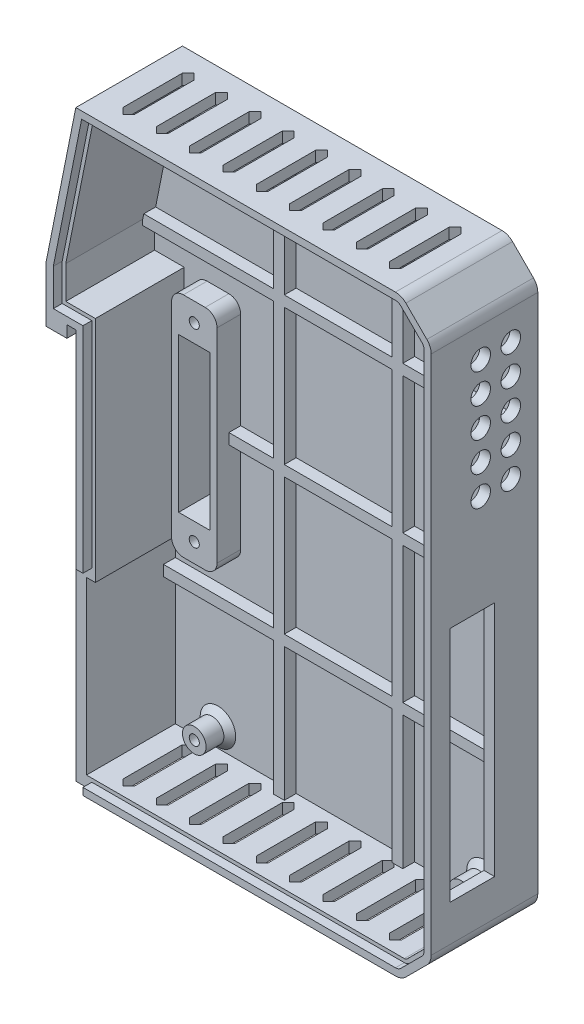
from build123d import *

# Parameters (mm, degrees)
BOSS_EXTRUDE1_DEPTH = 1.5
BOSS_EXTRUDE2_DEPTH = 16.5
BOSS_EXTRUDE3_DEPTH = 4
SKETCH5_W           = 18.2
SKETCH5_H           = 23
BOSS_EXTRUDE4_DEPTH = 2
SKETCH6_R           = 2
BOSS_EXTRUDE5_DEPTH = 4
CHAMFER1_SIZE       = 1
SKETCH7_W           = 3.5
SKETCH7_H           = 32.5
CUT_EXTRUDE1_DEPTH  = 0.5
SKETCH8_W           = 1.4
SKETCH8_H           = 21
BOSS_EXTRUDE6_DEPTH = 2.9
SKETCH9_R           = 0.85
CUT_EXTRUDE2_DEPTH  = 4
SKETCH10_W          = 5.28
SKETCH10_H          = 26
CUT_EXTRUDE3_DEPTH  = 120.921849552
SKETCH11_R          = 0.85
CUT_EXTRUDE4_DEPTH  = 4
CUT_EXTRUDE5_START  = -1.5
CUT_EXTRUDE5_DEPTH  = 1.5
SKETCH15_W          = 2.7
SKETCH15_H          = 32.5
CUT_EXTRUDE6_DEPTH  = 1.5
CUT_EXTRUDE7_DEPTH  = 1.8
SKETCH17_W          = 7.517
SKETCH17_H          = 40.043
CUT_EXTRUDE8_DEPTH  = 1.8
SKETCH18_R          = 1.65
CUT_EXTRUDE9_DEPTH  = 1.8


with BuildPart() as part:
    # Sketch2 → Boss-Extrude1 (new body)
    with BuildSketch(Plane.XY):
        with BuildLine():
            Line((0, 0), (58.964466094, 0))
            ThreePointArc((58.964466094, 0), (59.921174675, 0.190301169), (60.732233047, 0.732233047))
            Line((60.732233047, 0.732233047), (64.267766953, 4.267766953))
            ThreePointArc((64.267766953, 4.267766953), (64.809698831, 5.078825325), (65, 6.035533906))
            Line((65, 6.035533906), (65, 93.964466094))
            ThreePointArc((65, 93.964466094), (64.809698831, 94.921174675), (64.267766953, 95.732233047))
            Line((64.267766953, 95.732233047), (60.732233047, 99.267766953))
            ThreePointArc((60.732233047, 99.267766953), (59.921174675, 99.809698831), (58.964466094, 100))
            Line((58.964466094, 100), (5, 100))
            Line((5, 100), (0, 75))
            Line((0, 75), (0, 65.5))
            Line((0, 65.5), (3.5, 65.5))
            Line((3.5, 65.5), (3.5, 67.5))
            Line((3.5, 67.5), (5, 67.5))
            Line((5, 67.5), (5, 32.5))
            Line((5, 32.5), (0, 32.5))
            Line((0, 32.5), (0, 0))
        make_face()
    extrude(amount=BOSS_EXTRUDE1_DEPTH)

    # Sketch3 → Boss-Extrude2 (add)
    with BuildSketch(Plane.XY.offset(1.5)):
        with BuildLine():
            Line((5, 32.5), (3.5, 32.5))
            Line((3.5, 32.5), (3.5, 0))
            Line((3.5, 0), (58.964466094, 0))
            ThreePointArc((58.964466094, 0), (59.921174675, 0.190301169), (60.732233047, 0.732233047))
            Line((60.732233047, 0.732233047), (64.267766953, 4.267766953))
            ThreePointArc((64.267766953, 4.267766953), (64.809698831, 5.078825325), (65, 6.035533906))
            Line((65, 6.035533906), (65, 93.964466094))
            ThreePointArc((65, 93.964466094), (64.809698831, 94.921174675), (64.267766953, 95.732233047))
            Line((64.267766953, 95.732233047), (60.732233047, 99.267766953))
            ThreePointArc((60.732233047, 99.267766953), (59.921174675, 99.809698831), (58.964466094, 100))
            Line((58.964466094, 100), (5, 100))
            Line((5, 100), (0, 75))
            Line((0, 75), (0, 65.5))
            Line((0, 65.5), (3.5, 65.5))
            Line((3.5, 65.5), (3.5, 67.5))
            Line((3.5, 67.5), (5, 67.5))
            Line((5, 67.5), (5, 32.5))
        make_face()
        with BuildLine():
            Line((6.8, 69.3), (6.8, 30.7))
            Line((6.8, 30.7), (5.3, 30.7))
            Line((5.3, 30.7), (5.3, 1.8))
            Line((5.3, 1.8), (58.964466094, 1.8))
            ThreePointArc((58.964466094, 1.8), (59.232344497, 1.853284327), (59.459440841, 2.005025253))
            Line((59.459440841, 2.005025253), (62.994974747, 5.540559159))
            ThreePointArc((62.994974747, 5.540559159), (63.146715673, 5.767655503), (63.2, 6.035533906))
            Line((63.2, 6.035533906), (63.2, 93.964466094))
            ThreePointArc((63.2, 93.964466094), (63.146715673, 94.232344497), (62.994974747, 94.459440841))
            Line((62.994974747, 94.459440841), (59.459440841, 97.994974747))
            ThreePointArc((59.459440841, 97.994974747), (59.232344497, 98.146715673), (58.964466094, 98.2))
            Line((58.964466094, 98.2), (6.475647025, 98.2))
            Line((6.475647025, 98.2), (1.8, 74.821764876))
            Line((1.8, 74.821764876), (1.8, 69.3))
            Line((1.8, 69.3), (6.8, 69.3))
        make_face(mode=Mode.SUBTRACT)
    extrude(amount=BOSS_EXTRUDE2_DEPTH)

    # Sketch4 → Boss-Extrude3 (add)
    with BuildSketch(Plane.XY.offset(1.5)):
        with BuildLine():
            Line((10.66, 30.8), (14.34, 30.8))
            ThreePointArc((14.34, 30.8), (15.754213562, 31.385786438), (16.34, 32.8))
            Line((16.34, 32.8), (16.34, 67.2))
            ThreePointArc((16.34, 67.2), (15.754213562, 68.614213562), (14.34, 69.2))
            Line((14.34, 69.2), (10.66, 69.2))
            ThreePointArc((10.66, 69.2), (9.245786438, 68.614213562), (8.66, 67.2))
            Line((8.66, 67.2), (8.66, 32.8))
            ThreePointArc((8.66, 32.8), (9.245786438, 31.385786438), (10.66, 30.8))
        make_face()
    extrude(amount=BOSS_EXTRUDE3_DEPTH)

    # Sketch5 → Boss-Extrude4 (add)
    with BuildSketch(Plane.XY.offset(1.5)):
        Polygon((1.975647025, 75.7), (23.9, 75.7), (23.9, 98.2), (25.7, 98.2), (25.7, 75.7), (43.9, 75.7), (43.9, 98.2), (45.7, 98.2), (45.7, 75.7), (63.2, 75.7), (63.2, 73.9), (45.7, 73.9), (45.7, 50.9), (63.2, 50.9), (63.2, 49.1), (45.7, 49.1), (45.7, 26.1), (63.2, 26.1), (63.2, 24.3), (45.7, 24.3), (45.7, 1.8), (43.9, 1.8), (43.9, 24.3), (25.7, 24.3), (25.7, 1.8), (23.9, 1.8), (23.9, 24.3), (5.3, 24.3), (5.3, 26.1), (23.9, 26.1), (23.9, 49.1), (16.34, 49.1), (16.34, 50.9), (23.9, 50.9), (23.9, 73.9), (1.8, 73.9), (1.8, 74.821764876), align=None)
        with Locations((34.8, 62.4)):
            Rectangle(SKETCH5_W, SKETCH5_H, mode=Mode.SUBTRACT)
        with Locations((34.8, 37.6)):
            Rectangle(SKETCH5_W, SKETCH5_H, mode=Mode.SUBTRACT)
    extrude(amount=BOSS_EXTRUDE4_DEPTH)

    # Sketch6 → Boss-Extrude5 (add)
    with BuildSketch(Plane.XY.offset(1.5)):
        with Locations((12.5, 5)):
            Circle(SKETCH6_R)
        with Locations((57.5, 5)):
            Circle(SKETCH6_R)
        with Locations((12.5, 95)):
            Circle(SKETCH6_R)
        with Locations((57.5, 95)):
            Circle(SKETCH6_R)
    extrude(amount=BOSS_EXTRUDE5_DEPTH)

    # Chamfer1
    chamfer1_edges = [part.edges().sort_by_distance(p)[0] for p in [
        (10.5, 5, 1.5),
        (55.5, 5, 1.5),
        (10.5, 95, 1.5),
        (55.5, 95, 1.5),
    ]]
    chamfer(chamfer1_edges, length=CHAMFER1_SIZE)

    # Sketch7 → Cut-Extrude1 (cut)
    with BuildSketch(Plane.XY.offset(1.5)):
        with Locations((1.75, 16.25)):
            Rectangle(SKETCH7_W, SKETCH7_H)
    extrude(amount=-CUT_EXTRUDE1_DEPTH, mode=Mode.SUBTRACT)

    # Sketch8 → Boss-Extrude6 (add)
    with BuildSketch(Plane.XY.offset(1)):
        with Locations((0.7, 10.5)):
            Rectangle(SKETCH8_W, SKETCH8_H)
    extrude(amount=BOSS_EXTRUDE6_DEPTH)

    # Sketch9 → Cut-Extrude2 (cut)
    with BuildSketch(Plane.XY.offset(5.5)):
        with Locations((12.5, 95)):
            Circle(SKETCH9_R)
        with Locations((57.5, 95)):
            Circle(SKETCH9_R)
        with Locations((57.5, 5)):
            Circle(SKETCH9_R)
        with Locations((12.5, 5)):
            Circle(SKETCH9_R)
    extrude(amount=-CUT_EXTRUDE2_DEPTH, mode=Mode.SUBTRACT)

    # Sketch10 → Cut-Extrude3 (cut, through all)
    with BuildSketch(Plane.XY.offset(5.5)):
        with Locations((12.5, 50)):
            Rectangle(SKETCH10_W, SKETCH10_H)
    extrude(amount=-CUT_EXTRUDE3_DEPTH, mode=Mode.SUBTRACT)

    # Sketch11 → Cut-Extrude4 (cut)
    with BuildSketch(Plane.XY.offset(5.5)):
        with Locations((12.5, 66)):
            Circle(SKETCH11_R)
        with Locations((12.5, 34)):
            Circle(SKETCH11_R)
    extrude(amount=-CUT_EXTRUDE4_DEPTH, mode=Mode.SUBTRACT)

    # Sketch12 → Loft2 section 0
    with BuildSketch(Plane.ZY.offset(-3.5)):
        with BuildLine():
            Line((7.75, 17.9), (10.25, 17.9))
            Line((10.25, 17.9), (10.25, 15.4))
            Line((10.25, 15.4), (7.75, 15.4))
            Line((7.75, 15.4), (7.75, 17.9))
        make_face()
    # Sketch13 → Loft2 section 1
    with BuildSketch(Plane.ZY.offset(-2.5)):
        with BuildLine():
            Line((8.75, 16.4), (9.25, 16.4))
            Line((9.25, 16.4), (9.25, 16.9))
            Line((9.25, 16.9), (8.75, 16.9))
            Line((8.75, 16.9), (8.75, 16.4))
        make_face()
    loft()

    # Sketch14 → Cut-Extrude5 (cut)
    with BuildSketch(Plane.XY.offset(18).offset(CUT_EXTRUDE5_START)):
        with BuildLine():
            Line((1.2, 74.881176584), (5.983764683, 98.8))
            Line((5.983764683, 98.8), (58.964466094, 98.8))
            ThreePointArc((58.964466094, 98.8), (59.461954556, 98.701043392), (59.88370491, 98.419238816))
            Line((59.88370491, 98.419238816), (63.419238816, 94.88370491))
            ThreePointArc((63.419238816, 94.88370491), (63.701043392, 94.461954556), (63.8, 93.964466094))
            Line((63.8, 93.964466094), (63.8, 6.035533906))
            ThreePointArc((63.8, 6.035533906), (63.701043392, 5.538045444), (63.419238816, 5.11629509))
            Line((63.419238816, 5.11629509), (59.88370491, 1.580761184))
            ThreePointArc((59.88370491, 1.580761184), (59.461954556, 1.298956608), (58.964466094, 1.2))
            Line((58.964466094, 1.2), (4.7, 1.2))
            Line((4.7, 1.2), (4.7, 31.3))
            Line((4.7, 31.3), (6.2, 31.3))
            Line((6.2, 31.3), (6.2, 68.7))
            Line((6.2, 68.7), (1.2, 68.7))
            Line((1.2, 68.7), (1.2, 74.881176584))
        make_face()
        with BuildLine():
            Line((1.8, 69.3), (1.8, 74.821764876))
            Line((1.8, 74.821764876), (6.475647025, 98.2))
            Line((6.475647025, 98.2), (58.964466094, 98.2))
            ThreePointArc((58.964466094, 98.2), (59.232344497, 98.146715673), (59.459440841, 97.994974747))
            Line((59.459440841, 97.994974747), (62.994974747, 94.459440841))
            ThreePointArc((62.994974747, 94.459440841), (63.146715673, 94.232344497), (63.2, 93.964466094))
            Line((63.2, 93.964466094), (63.2, 6.035533906))
            ThreePointArc((63.2, 6.035533906), (63.146715673, 5.767655503), (62.994974747, 5.540559159))
            Line((62.994974747, 5.540559159), (59.459440841, 2.005025253))
            ThreePointArc((59.459440841, 2.005025253), (59.232344497, 1.853284327), (58.964466094, 1.8))
            Line((58.964466094, 1.8), (5.3, 1.8))
            Line((5.3, 1.8), (5.3, 30.7))
            Line((5.3, 30.7), (6.8, 30.7))
            Line((6.8, 30.7), (6.8, 69.3))
            Line((6.8, 69.3), (1.8, 69.3))
        make_face(mode=Mode.SUBTRACT)
    extrude(amount=CUT_EXTRUDE5_DEPTH, mode=Mode.SUBTRACT)

    # Sketch15 → Cut-Extrude6 (cut)
    with BuildSketch(Plane.XY.offset(18)):
        with Locations((4.85, 16.25)):
            Rectangle(SKETCH15_W, SKETCH15_H)
    extrude(amount=-CUT_EXTRUDE6_DEPTH, mode=Mode.SUBTRACT)

    # Sketch16 → Cut-Extrude7 (cut)
    with BuildSketch(Plane.XZ):
        Polygon((8.964, 14), (9.964, 15), (10.964, 14), (10.964, 4), (9.964, 3), (8.964, 4), align=None)
        Polygon((15.594, 3), (14.594, 4), (14.594, 14), (15.594, 15), (16.594, 14), (16.594, 4), align=None)
        Polygon((21.224, 3), (20.224, 4), (20.224, 14), (21.224, 15), (22.224, 14), (22.224, 4), align=None)
        Polygon((26.854, 3), (25.854, 4), (25.854, 14), (26.854, 15), (27.854, 14), (27.854, 4), align=None)
        Polygon((32.484, 3), (31.484, 4), (31.484, 14), (32.484, 15), (33.484, 14), (33.484, 4), align=None)
        Polygon((38.114, 3), (37.114, 4), (37.114, 14), (38.114, 15), (39.114, 14), (39.114, 4), align=None)
        Polygon((43.744, 3), (42.744, 4), (42.744, 14), (43.744, 15), (44.744, 14), (44.744, 4), align=None)
        Polygon((49.374, 3), (48.374, 4), (48.374, 14), (49.374, 15), (50.374, 14), (50.374, 4), align=None)
        Polygon((55.004, 3), (54.004, 4), (54.004, 14), (55.004, 15), (56.004, 14), (56.004, 4), align=None)
    cut_extrude7 = extrude(amount=-CUT_EXTRUDE7_DEPTH, mode=Mode.SUBTRACT)

    # Mirror1: Cut-Extrude7 across plane
    add(cut_extrude7.mirror(Plane(origin=(0, 50, 0), x_dir=(0, 0, 1), z_dir=(0, -1, 0))), mode=Mode.SUBTRACT)

    # Sketch17 → Cut-Extrude8 (cut)
    with BuildSketch(Plane(origin=(65, 0, 0), x_dir=(0, 0, -1), z_dir=(1, 0, 0))):
        with Locations((-11.0485, 32.2195)):
            Rectangle(SKETCH17_W, SKETCH17_H)
    extrude(amount=-CUT_EXTRUDE8_DEPTH, mode=Mode.SUBTRACT)

    # Sketch18 → Cut-Extrude9 (cut)
    with BuildSketch(Plane(origin=(65, 0, 0), x_dir=(0, 0, -1), z_dir=(1, 0, 0))):
        with Locations(Location((-9.64, 68.969, 0), (0, 0, 90))):
            Circle(SKETCH18_R)
        with Locations(Location((-4.56, 68.969, 0), (0, 0, 90))):
            Circle(SKETCH18_R)
        with Locations(Location((-4.56, 73.969, 0), (0, 0, 90))):
            Circle(SKETCH18_R)
        with Locations(Location((-4.56, 78.969, 0), (0, 0, 90))):
            Circle(SKETCH18_R)
        with Locations(Location((-4.56, 83.969, 0), (0, 0, 90))):
            Circle(SKETCH18_R)
        with Locations(Location((-4.56, 88.969, 0), (0, 0, 90))):
            Circle(SKETCH18_R)
        with Locations(Location((-9.64, 73.969, 0), (0, 0, 90))):
            Circle(SKETCH18_R)
        with Locations(Location((-9.64, 78.969, 0), (0, 0, 90))):
            Circle(SKETCH18_R)
        with Locations(Location((-9.64, 83.969, 0), (0, 0, 90))):
            Circle(SKETCH18_R)
        with Locations(Location((-9.64, 88.969, 0), (0, 0, 90))):
            Circle(SKETCH18_R)
    extrude(amount=-CUT_EXTRUDE9_DEPTH, mode=Mode.SUBTRACT)


solid = part.part
